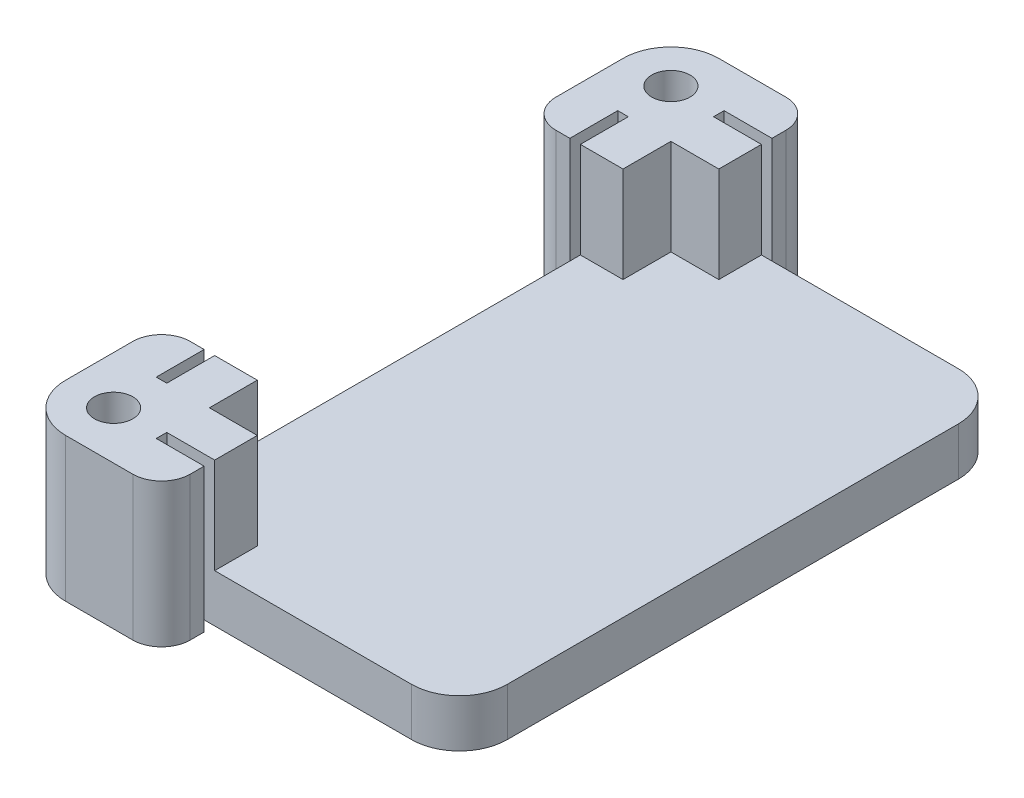
from build123d import *

# Parameters (mm, degrees)
SKETCH2_W          = 93.58
SKETCH2_H          = 68.18
BASE_DEPTH         = 5
SKETCH2_7_W        = 4.45
SKETCH2_7_H        = 4.45
SKETCH2_7_H_2      = 5
SKETCH2_7_W_2      = 5
SKETCH2_7_H_3      = 1.1
SKETCH2_7_W_3      = 1.1
WALLS_DEPTH        = 15
SKETCH2_10_W       = 1.1
SKETCH2_10_H       = 5
SKETCH2_10_H_2     = 38.18
SKETCH2_10_W_2     = 5
SKETCH2_10_H_3     = 1.1
SKETCH2_10_W_3     = 63.58
ACRYLIC_CUT_DEPTH  = 60.803279174
SKETCH4_W          = 63.58
SKETCH4_H          = 4.45
SKETCH4_W_2        = 4.45
SKETCH4_H_2        = 38.18
CUT_EXTRUDE2_DEPTH = 5
SKETCH5_R          = 2.25
SCREW_HOLES_DEPTH  = 5
FILLET1_R          = 5
FILLET2_R          = 3
SKETCH8_R          = 2
CUT_EXTRUDE3_DEPTH = 15
SKETCH7_W          = 13.03
SKETCH7_H          = 57.08
SKETCH7_W_2        = 40
SKETCH7_H_2        = 68.18
TOP_CUT_DEPTH      = 60.803279174
FILLET4_R          = 5


with BuildPart() as part:
    # Sketch2 → Base (new body)
    with BuildSketch(Plane(origin=(0, 0, 0), x_dir=(1, 0, 0), z_dir=(0, 1, 0))):
        Rectangle(SKETCH2_W, SKETCH2_H)
    extrude(amount=BASE_DEPTH)

    # Sketch2<7> → Walls (add)
    with BuildSketch(Plane(origin=(0, 0, 0), x_dir=(1, 0, 0), z_dir=(0, 1, 0))):
        with Locations((-39.015, 26.315)):
            Rectangle(SKETCH2_7_W, SKETCH2_7_H)
        with Locations((-39.015, 21.59)):
            Rectangle(SKETCH2_7_W, SKETCH2_7_H_2)
        with Locations((-44.565, 21.59)):
            Rectangle(SKETCH2_7_W, SKETCH2_7_H_2)
        with Locations((-44.565, 26.315)):
            Rectangle(SKETCH2_7_W, SKETCH2_7_H)
        with Locations((-44.565, 31.865)):
            Rectangle(SKETCH2_7_W, SKETCH2_7_H)
        with Locations((-39.015, 31.865)):
            Rectangle(SKETCH2_7_W, SKETCH2_7_H)
        with Locations((-34.29, 31.865)):
            Rectangle(SKETCH2_7_W_2, SKETCH2_7_H)
        with Locations((-34.29, 26.315)):
            Rectangle(SKETCH2_7_W_2, SKETCH2_7_H)
        with Locations((-34.29, 29.09)):
            Rectangle(SKETCH2_7_W_2, SKETCH2_7_H_3)
        with Locations((-39.015, 29.09)):
            Rectangle(SKETCH2_7_W, SKETCH2_7_H_3)
        with Locations((-44.565, 29.09)):
            Rectangle(SKETCH2_7_W, SKETCH2_7_H_3)
        with Locations((-41.79, 31.865)):
            Rectangle(SKETCH2_7_W_3, SKETCH2_7_H)
        with Locations((-41.79, 26.315)):
            Rectangle(SKETCH2_7_W_3, SKETCH2_7_H)
        with Locations((-41.79, 29.09)):
            Rectangle(SKETCH2_7_W_3, SKETCH2_7_H_3)
        with Locations((-41.79, 21.59)):
            Rectangle(SKETCH2_7_W_3, SKETCH2_7_H_2)
        with Locations((-34.29, -26.315)):
            Rectangle(SKETCH2_7_W_2, SKETCH2_7_H)
        with Locations((-34.29, -31.865)):
            Rectangle(SKETCH2_7_W_2, SKETCH2_7_H)
        with Locations((-39.015, -31.865)):
            Rectangle(SKETCH2_7_W, SKETCH2_7_H)
        with Locations((-39.015, -26.315)):
            Rectangle(SKETCH2_7_W, SKETCH2_7_H)
        with Locations((-44.565, -26.315)):
            Rectangle(SKETCH2_7_W, SKETCH2_7_H)
        with Locations((-44.565, -31.865)):
            Rectangle(SKETCH2_7_W, SKETCH2_7_H)
        with Locations((-44.565, -29.09)):
            Rectangle(SKETCH2_7_W, SKETCH2_7_H_3)
        with Locations((-41.79, -31.865)):
            Rectangle(SKETCH2_7_W_3, SKETCH2_7_H)
        with Locations((-41.79, -29.09)):
            Rectangle(SKETCH2_7_W_3, SKETCH2_7_H_3)
        with Locations((-41.79, -26.315)):
            Rectangle(SKETCH2_7_W_3, SKETCH2_7_H)
        with Locations((-44.565, -21.59)):
            Rectangle(SKETCH2_7_W, SKETCH2_7_H_2)
        with Locations((-39.015, -21.59)):
            Rectangle(SKETCH2_7_W, SKETCH2_7_H_2)
        with Locations((-41.79, -21.59)):
            Rectangle(SKETCH2_7_W_3, SKETCH2_7_H_2)
        with Locations((-39.015, -29.09)):
            Rectangle(SKETCH2_7_W, SKETCH2_7_H_3)
        with Locations((-34.29, -29.09)):
            Rectangle(SKETCH2_7_W_2, SKETCH2_7_H_3)
        with Locations((39.015, -21.59)):
            Rectangle(SKETCH2_7_W, SKETCH2_7_H_2)
        with Locations((44.565, -21.59)):
            Rectangle(SKETCH2_7_W, SKETCH2_7_H_2)
        with Locations((44.565, -26.315)):
            Rectangle(SKETCH2_7_W, SKETCH2_7_H)
        with Locations((39.015, -26.315)):
            Rectangle(SKETCH2_7_W, SKETCH2_7_H)
        with Locations((34.29, -31.865)):
            Rectangle(SKETCH2_7_W_2, SKETCH2_7_H)
        with Locations((39.015, -31.865)):
            Rectangle(SKETCH2_7_W, SKETCH2_7_H)
        with Locations((44.565, -31.865)):
            Rectangle(SKETCH2_7_W, SKETCH2_7_H)
        with Locations((41.79, -31.865)):
            Rectangle(SKETCH2_7_W_3, SKETCH2_7_H)
        with Locations((44.565, -29.09)):
            Rectangle(SKETCH2_7_W, SKETCH2_7_H_3)
        with Locations((41.79, -26.315)):
            Rectangle(SKETCH2_7_W_3, SKETCH2_7_H)
        with Locations((41.79, -21.59)):
            Rectangle(SKETCH2_7_W_3, SKETCH2_7_H_2)
        with Locations((34.29, -26.315)):
            Rectangle(SKETCH2_7_W_2, SKETCH2_7_H)
        with Locations((34.29, -29.09)):
            Rectangle(SKETCH2_7_W_2, SKETCH2_7_H_3)
        with Locations((39.015, -29.09)):
            Rectangle(SKETCH2_7_W, SKETCH2_7_H_3)
        with Locations((41.79, -29.09)):
            Rectangle(SKETCH2_7_W_3, SKETCH2_7_H_3)
        with Locations((34.29, 26.315)):
            Rectangle(SKETCH2_7_W_2, SKETCH2_7_H)
        with Locations((34.29, 31.865)):
            Rectangle(SKETCH2_7_W_2, SKETCH2_7_H)
        with Locations((39.015, 31.865)):
            Rectangle(SKETCH2_7_W, SKETCH2_7_H)
        with Locations((39.015, 26.315)):
            Rectangle(SKETCH2_7_W, SKETCH2_7_H)
        with Locations((44.565, 26.315)):
            Rectangle(SKETCH2_7_W, SKETCH2_7_H)
        with Locations((44.565, 31.865)):
            Rectangle(SKETCH2_7_W, SKETCH2_7_H)
        with Locations((44.565, 21.59)):
            Rectangle(SKETCH2_7_W, SKETCH2_7_H_2)
        with Locations((39.015, 21.59)):
            Rectangle(SKETCH2_7_W, SKETCH2_7_H_2)
        with Locations((41.79, 21.59)):
            Rectangle(SKETCH2_7_W_3, SKETCH2_7_H_2)
        with Locations((41.79, 26.315)):
            Rectangle(SKETCH2_7_W_3, SKETCH2_7_H)
        with Locations((41.79, 31.865)):
            Rectangle(SKETCH2_7_W_3, SKETCH2_7_H)
        with Locations((44.565, 29.09)):
            Rectangle(SKETCH2_7_W, SKETCH2_7_H_3)
        with Locations((41.79, 29.09)):
            Rectangle(SKETCH2_7_W_3, SKETCH2_7_H_3)
        with Locations((39.015, 29.09)):
            Rectangle(SKETCH2_7_W, SKETCH2_7_H_3)
        with Locations((34.29, 29.09)):
            Rectangle(SKETCH2_7_W_2, SKETCH2_7_H_3)
    extrude(amount=WALLS_DEPTH)

    # Sketch2<10> → Acrylic Cut (cut, through all)
    with BuildSketch(Plane(origin=(0, 0, 0), x_dir=(1, 0, 0), z_dir=(0, 1, 0))):
        with Locations((41.79, -21.59)):
            Rectangle(SKETCH2_10_W, SKETCH2_10_H)
        with Locations((41.79, 0)):
            Rectangle(SKETCH2_10_W, SKETCH2_10_H_2)
        with Locations((34.29, -29.09)):
            Rectangle(SKETCH2_10_W_2, SKETCH2_10_H_3)
        with Locations((0, -29.09)):
            Rectangle(SKETCH2_10_W_3, SKETCH2_10_H_3)
        with Locations((41.79, 21.59)):
            Rectangle(SKETCH2_10_W, SKETCH2_10_H)
        with Locations((34.29, 29.09)):
            Rectangle(SKETCH2_10_W_2, SKETCH2_10_H_3)
        with Locations((0, 29.09)):
            Rectangle(SKETCH2_10_W_3, SKETCH2_10_H_3)
        with Locations((-34.29, 29.09)):
            Rectangle(SKETCH2_10_W_2, SKETCH2_10_H_3)
        with Locations((-41.79, 21.59)):
            Rectangle(SKETCH2_10_W, SKETCH2_10_H)
        with Locations((-41.79, 0)):
            Rectangle(SKETCH2_10_W, SKETCH2_10_H_2)
        with Locations((-41.79, -21.59)):
            Rectangle(SKETCH2_10_W, SKETCH2_10_H)
        with Locations((-34.29, -29.09)):
            Rectangle(SKETCH2_10_W_2, SKETCH2_10_H_3)
    extrude(amount=ACRYLIC_CUT_DEPTH, mode=Mode.SUBTRACT)

    # Sketch4 → Cut-Extrude2 (cut)
    with BuildSketch(Plane(origin=(0, 5, 0), x_dir=(1, 0, 0), z_dir=(0, 1, 0))):
        with Locations((0, -31.865)):
            Rectangle(SKETCH4_W, SKETCH4_H)
        with Locations((44.565, 0)):
            Rectangle(SKETCH4_W_2, SKETCH4_H_2)
        with Locations((0, 31.865)):
            Rectangle(SKETCH4_W, SKETCH4_H)
        with Locations((-44.565, 0)):
            Rectangle(SKETCH4_W_2, SKETCH4_H_2)
    extrude(amount=-CUT_EXTRUDE2_DEPTH, mode=Mode.SUBTRACT)

    # Sketch5 → Screw Holes (add)
    with BuildSketch(Plane(origin=(0, 5, 0), x_dir=(1, 0, 0), z_dir=(0, 1, 0))):
        with Locations(Location((36.79, -10.16, 0), (0, 0, 90))):
            Circle(SKETCH5_R)
        with Locations(Location((16.79, -10.16, 0), (0, 0, 90))):
            Circle(SKETCH5_R)
        with Locations(Location((26.79, 19.64, 0), (0, 0, 90))):
            Circle(SKETCH5_R)
    extrude(amount=SCREW_HOLES_DEPTH)

    # Fillet1
    fillet1_edges = [part.edges().sort_by_distance(p)[0] for p in [
        (-46.79, 7.5, 34.09),
        (46.79, 7.5, 34.09),
        (46.79, 7.5, -34.09),
        (-46.79, 7.5, -34.09),
    ]]
    fillet(fillet1_edges, radius=FILLET1_R)

    # Fillet2
    fillet2_edges = [part.edges().sort_by_distance(p)[0] for p in [
        (31.79, 7.5, -34.09),
        (46.79, 7.5, -19.09),
        (-46.79, 7.5, -19.09),
        (-31.79, 7.5, -34.09),
        (-46.79, 7.5, 19.09),
        (-31.79, 7.5, 34.09),
        (31.79, 7.5, 34.09),
        (46.79, 7.5, 19.09),
    ]]
    fillet(fillet2_edges, radius=FILLET2_R)

    # Sketch8 → Cut-Extrude3 (cut)
    with BuildSketch(Plane(origin=(0, 15, 0), x_dir=(1, 0, 0), z_dir=(0, 1, 0))):
        with Locations(Location((41.79, -29.09, 0), (0, 0, 270))):
            Circle(SKETCH8_R)
        with Locations(Location((-41.79, -29.09, 0), (0, 0, 90))):
            Circle(SKETCH8_R)
        with Locations(Location((-41.79, 29.09, 0), (0, 0, 270))):
            Circle(SKETCH8_R)
        with Locations(Location((41.79, 29.09, 0), (0, 0, 90))):
            Circle(SKETCH8_R)
    extrude(amount=-CUT_EXTRUDE3_DEPTH, mode=Mode.SUBTRACT)

    # Sketch7 → Top Cut (cut, through all)
    with BuildSketch(Plane.XZ):
        with Locations((0.275, 0)):
            Rectangle(SKETCH7_W, SKETCH7_H)
        with Locations((26.79, 0)):
            Rectangle(SKETCH7_W_2, SKETCH7_H_2)
    extrude(amount=-TOP_CUT_DEPTH, mode=Mode.SUBTRACT)

    # Fillet4
    fillet4_edges = [part.edges().sort_by_distance(p)[0] for p in [
        (-6.24, 2.5, 28.54),
        (-6.24, 2.5, -28.54),
    ]]
    fillet(fillet4_edges, radius=FILLET4_R)


solid = part.part
